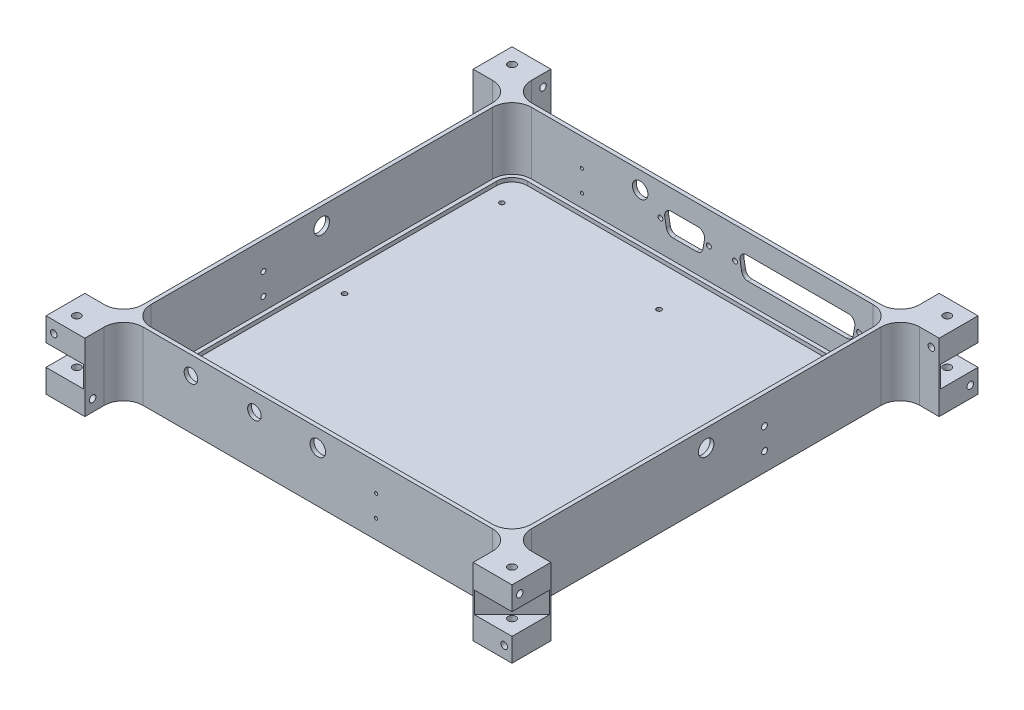
from build123d import *

# Parameters (mm, degrees)
BOSS_EXTRUDE1_DEPTH                = 17.5
CUT_EXTRUDE1_DEPTH                 = 32
CUT_EXTRUDE2_DEPTH                 = 2
BOSS_EXTRUDE2_DEPTH                = 2
CUT_EXTRUDE3_DEPTH                 = 11
CIRPATTERN1_COUNT                  = 4
M3_CLEARANCE_HOLE1_D               = 3.4
M3_CLEARANCE_HOLE1_DEPTH           = 20
M3_CLEARANCE_HOLE1_TIP             = 1.021463052
M3_CLEARANCE_HOLE1_ON_FACE_2_D     = 3.4
M3_CLEARANCE_HOLE1_ON_FACE_2_DEPTH = 20
M3_CLEARANCE_HOLE1_ON_FACE_2_TIP   = 1.021463052
M3_CLEARANCE_HOLE1_ON_FACE_3_D     = 3.4
M3_CLEARANCE_HOLE1_ON_FACE_3_DEPTH = 20
M3_CLEARANCE_HOLE1_ON_FACE_3_TIP   = 1.021463052
M3_CLEARANCE_HOLE1_ON_FACE_4_D     = 3.4
M3_CLEARANCE_HOLE1_ON_FACE_4_DEPTH = 20
M3_CLEARANCE_HOLE1_ON_FACE_4_TIP   = 1.021463052
CUT_EXTRUDE4_REACH                 = 253.357
SKETCH12_R                         = 4
SKETCH12_R_2                       = 1.5
SKETCH13_R                         = 2
CUT_EXTRUDE5_DEPTH                 = 174.692256592
CIRPATTERN2_COUNT                  = 4
M3X0_5_TAPPED_HOLE1_D              = 2.5
M3X0_5_TAPPED_HOLE1_DEPTH          = 5
M3X0_5_TAPPED_HOLE1_TIP            = 0.751075774
CUT_EXTRUDE6_START                 = -10
SKETCH21_R                         = 4
CUT_EXTRUDE6_DEPTH                 = 10
M3X0_5_TAPPED_HOLE2_D              = 2.5
M3X0_5_TAPPED_HOLE2_DEPTH          = 5
M3X0_5_TAPPED_HOLE2_TIP            = 0.751075774
SKETCH24_R                         = 4
SKETCH24_R_2                       = 3.5
CUT_EXTRUDE7_DEPTH                 = 10
M2X0_4_TAPPED_HOLE1_D              = 1.6
M2X0_4_TAPPED_HOLE1_DEPTH          = 5.2
M2X0_4_TAPPED_HOLE1_TIP            = 0.480688495
SKETCH28_R                         = 4
CUT_EXTRUDE8_DEPTH                 = 10
M3X0_5_TAPPED_HOLE3_D              = 2.5
M3X0_5_TAPPED_HOLE3_DEPTH          = 7.5
M3X0_5_TAPPED_HOLE3_TIP            = 0.751075774
M2X0_4_TAPPED_HOLE2_D              = 1.6
M2X0_4_TAPPED_HOLE2_DEPTH          = 5.2
M2X0_4_TAPPED_HOLE2_TIP            = 0.480688495


with BuildPart() as part:
    # Sketch1 → Boss-Extrude1 (new, symmetric)
    with BuildSketch(Plane(origin=(0, 0, 0), x_dir=(1, 0, 0), z_dir=(0, 1, 0))):
        with BuildLine():
            ThreePointArc((-110, 100), (-102.928932188, 97.071067812), (-100, 90))
            Line((-100, 90), (-100, -90))
            ThreePointArc((-100, -90), (-102.928932188, -97.071067812), (-110, -100))
            Line((-110, -100), (-120, -100))
            Line((-120, -100), (-120, -120))
            Line((-120, -120), (-100, -120))
            Line((-100, -120), (-100, -110))
            ThreePointArc((-100, -110), (-97.071067812, -102.928932188), (-90, -100))
            Line((-90, -100), (90, -100))
            ThreePointArc((90, -100), (97.071067812, -102.928932188), (100, -110))
            Line((100, -110), (100, -120))
            Line((100, -120), (120, -120))
            Line((120, -120), (120, -100))
            Line((120, -100), (110, -100))
            ThreePointArc((110, -100), (102.928932188, -97.071067812), (100, -90))
            Line((100, -90), (100, 90))
            ThreePointArc((100, 90), (102.928932188, 97.071067812), (110, 100))
            Line((110, 100), (120, 100))
            Line((120, 100), (120, 120))
            Line((120, 120), (100, 120))
            Line((100, 120), (100, 110))
            ThreePointArc((100, 110), (97.071067812, 102.928932188), (90, 100))
            Line((90, 100), (-90, 100))
            ThreePointArc((-90, 100), (-97.071067812, 102.928932188), (-100, 110))
            Line((-100, 110), (-100, 120))
            Line((-100, 120), (-120, 120))
            Line((-120, 120), (-120, 100))
            Line((-120, 100), (-110, 100))
        make_face()
    extrude(amount=BOSS_EXTRUDE1_DEPTH, both=True)

    # Sketch3 → Cut-Extrude1 (cut)
    with BuildSketch(Plane(origin=(0, 17.5, 0), x_dir=(1, 0, 0), z_dir=(0, 1, 0))):
        with BuildLine():
            Line((-88, 98), (88, 98))
            ThreePointArc((88, 98), (95.071067812, 95.071067812), (98, 88))
            Line((98, 88), (98, -88))
            ThreePointArc((98, -88), (95.071067812, -95.071067812), (88, -98))
            Line((88, -98), (-88, -98))
            ThreePointArc((-88, -98), (-95.071067812, -95.071067812), (-98, -88))
            Line((-98, -88), (-98, 88))
            ThreePointArc((-98, 88), (-95.071067812, 95.071067812), (-88, 98))
        make_face()
    extrude(amount=-CUT_EXTRUDE1_DEPTH, mode=Mode.SUBTRACT)

    # Sketch4 → Cut-Extrude2 (cut)
    with BuildSketch(Plane(origin=(0, -14.5, 0), x_dir=(1, 0, 0), z_dir=(0, 1, 0))):
        with BuildLine():
            Line((-88, -96), (88, -96))
            ThreePointArc((88, -96), (93.656854249, -93.656854249), (96, -88))
            Line((96, -88), (96, 88))
            ThreePointArc((96, 88), (93.656854249, 93.656854249), (88, 96))
            Line((88, 96), (-88, 96))
            ThreePointArc((-88, 96), (-93.656854249, 93.656854249), (-96, 88))
            Line((-96, 88), (-96, -88))
            ThreePointArc((-96, -88), (-93.656854249, -93.656854249), (-88, -96))
        make_face()
    extrude(amount=-CUT_EXTRUDE2_DEPTH, mode=Mode.SUBTRACT)

    # Sketch5 → Boss-Extrude2 (add)
    with BuildSketch(Plane.XZ.offset(17.5)):
        with BuildLine():
            Line((98, -88), (98, 88))
            ThreePointArc((98, 88), (95.071067812, 95.071067812), (88, 98))
            Line((88, 98), (-88, 98))
            ThreePointArc((-88, 98), (-95.071067812, 95.071067812), (-98, 88))
            Line((-98, 88), (-98, -88))
            ThreePointArc((-98, -88), (-95.071067812, -95.071067812), (-88, -98))
            Line((-88, -98), (88, -98))
            ThreePointArc((88, -98), (95.071067812, -95.071067812), (98, -88))
        make_face()
    extrude(amount=BOSS_EXTRUDE2_DEPTH)

    # Sketch6 → Cut-Extrude3 (cut)
    with BuildSketch(Plane(origin=(0, 5.5, 0), x_dir=(1, 0, 0), z_dir=(0, 1, 0))):
        Polygon((-120, 120), (-120, 100.61731573), (-100.61731573, 120), align=None)
    cut_extrude3 = extrude(amount=-CUT_EXTRUDE3_DEPTH, mode=Mode.SUBTRACT)

    # CirPattern1: Cut-Extrude3 ×4 about axis
    cirpattern1_axis = Axis((0, 0, 0), (0, 1, 0))
    for i in range(1, CIRPATTERN1_COUNT):
        add(cut_extrude3.rotate(cirpattern1_axis, i * 360 / CIRPATTERN1_COUNT), mode=Mode.SUBTRACT)

    # M3 Clearance Hole1
    with Locations(Plane(origin=(116, 11.5, -120), x_dir=(-1, 0, 0), z_dir=(0, 0, -1))):
        with Locations((0, 0), (232, -23)):
            Hole(M3_CLEARANCE_HOLE1_D / 2, depth=M3_CLEARANCE_HOLE1_DEPTH)
            with Locations((0, 0, -(M3_CLEARANCE_HOLE1_DEPTH + M3_CLEARANCE_HOLE1_TIP / 2))):  # 118° drill point
                Cone(0, M3_CLEARANCE_HOLE1_D / 2, M3_CLEARANCE_HOLE1_TIP, mode=Mode.SUBTRACT)

    # M3 Clearance Hole1 on face 2
    with Locations(Plane(origin=(120, 11.5, 116), x_dir=(0, 0, 1), z_dir=(1, 0, 0))):
        with Locations((0, 0), (-232, 23)):
            Hole(M3_CLEARANCE_HOLE1_ON_FACE_2_D / 2, depth=M3_CLEARANCE_HOLE1_ON_FACE_2_DEPTH)
            with Locations((0, 0, -(M3_CLEARANCE_HOLE1_ON_FACE_2_DEPTH + M3_CLEARANCE_HOLE1_ON_FACE_2_TIP / 2))):  # 118° drill point
                Cone(0, M3_CLEARANCE_HOLE1_ON_FACE_2_D / 2, M3_CLEARANCE_HOLE1_ON_FACE_2_TIP, mode=Mode.SUBTRACT)

    # M3 Clearance Hole1 on face 3
    with Locations(Plane(origin=(-120, 11.5, -116), x_dir=(0, 0, -1), z_dir=(-1, 0, 0))):
        with Locations((0, 0), (-232, 23)):
            Hole(M3_CLEARANCE_HOLE1_ON_FACE_3_D / 2, depth=M3_CLEARANCE_HOLE1_ON_FACE_3_DEPTH)
            with Locations((0, 0, -(M3_CLEARANCE_HOLE1_ON_FACE_3_DEPTH + M3_CLEARANCE_HOLE1_ON_FACE_3_TIP / 2))):  # 118° drill point
                Cone(0, M3_CLEARANCE_HOLE1_ON_FACE_3_D / 2, M3_CLEARANCE_HOLE1_ON_FACE_3_TIP, mode=Mode.SUBTRACT)

    # M3 Clearance Hole1 on face 4
    with Locations(Plane(origin=(-116, 11.5, 120), x_dir=(1, 0, 0), z_dir=(0, 0, 1))):
        with Locations((0, 0), (232, -23)):
            Hole(M3_CLEARANCE_HOLE1_ON_FACE_4_D / 2, depth=M3_CLEARANCE_HOLE1_ON_FACE_4_DEPTH)
            with Locations((0, 0, -(M3_CLEARANCE_HOLE1_ON_FACE_4_DEPTH + M3_CLEARANCE_HOLE1_ON_FACE_4_TIP / 2))):  # 118° drill point
                Cone(0, M3_CLEARANCE_HOLE1_ON_FACE_4_D / 2, M3_CLEARANCE_HOLE1_ON_FACE_4_TIP, mode=Mode.SUBTRACT)

    # Sketch12 → Cut-Extrude4 (cut, up to next)
    with BuildSketch(Plane(origin=(100, 0, 0), x_dir=(0, 0, -1), z_dir=(1, 0, 0)), mode=Mode.PRIVATE) as cut_extrude4_sk1:
        with Locations((0, 8.6)):
            Circle(SKETCH12_R)
    cut_extrude4_tool1 = extrude(cut_extrude4_sk1.sketch, amount=-CUT_EXTRUDE4_REACH, mode=Mode.PRIVATE) & part.part
    # Sketch12 → Cut-Extrude4 (cut, up to next)
    with BuildSketch(Plane(origin=(100, 0, 0), x_dir=(0, 0, -1), z_dir=(1, 0, 0)), mode=Mode.PRIVATE) as cut_extrude4_sk2:
        with Locations((30, 3.25)):
            Circle(SKETCH12_R_2)
    cut_extrude4_tool2 = extrude(cut_extrude4_sk2.sketch, amount=-CUT_EXTRUDE4_REACH, mode=Mode.PRIVATE) & part.part
    # Sketch12 → Cut-Extrude4 (cut, up to next)
    with BuildSketch(Plane(origin=(100, 0, 0), x_dir=(0, 0, -1), z_dir=(1, 0, 0)), mode=Mode.PRIVATE) as cut_extrude4_sk3:
        with Locations((30.077305636, -7.85)):
            Circle(SKETCH12_R_2)
    cut_extrude4_tool3 = extrude(cut_extrude4_sk3.sketch, amount=-CUT_EXTRUDE4_REACH, mode=Mode.PRIVATE) & part.part
    add(cut_extrude4_tool1.solids().sort_by_distance((100, 8.6, 0))[0], mode=Mode.SUBTRACT)
    add(cut_extrude4_tool2.solids().sort_by_distance((100, 3.25, -30))[0], mode=Mode.SUBTRACT)
    add(cut_extrude4_tool3.solids().sort_by_distance((100, -7.85, -30.077306))[0], mode=Mode.SUBTRACT)

    # Sketch13 → Cut-Extrude5 (cut, through all)
    with BuildSketch(Plane(origin=(0, 17.5, 0), x_dir=(1, 0, 0), z_dir=(0, 1, 0))):
        with Locations((-112.076424818, 112.076424818)):
            Circle(SKETCH13_R)
    cut_extrude5 = extrude(amount=-CUT_EXTRUDE5_DEPTH, mode=Mode.SUBTRACT)

    # CirPattern2: Cut-Extrude5 ×4 about axis
    cirpattern2_axis = Axis((0, 0, 0), (0, 1, 0))
    for i in range(1, CIRPATTERN2_COUNT):
        add(cut_extrude5.rotate(cirpattern2_axis, i * 360 / CIRPATTERN2_COUNT), mode=Mode.SUBTRACT)

    # M3x0.5 Tapped Hole1
    with Locations(Plane(origin=(0, -16.5, 0), x_dir=(1, 0, 0), z_dir=(0, 1, 0))):
        with Locations((-87, 81.75), (1, 74.75), (83, 88.75), (87, 0.75), (87, -87.25), (0, -87.25), (-87, -87.25), (-87, 0.75)):
            Hole(M3X0_5_TAPPED_HOLE1_D / 2, depth=M3X0_5_TAPPED_HOLE1_DEPTH)
            with Locations((0, 0, -(M3X0_5_TAPPED_HOLE1_DEPTH + M3X0_5_TAPPED_HOLE1_TIP / 2))):  # 118° drill point
                Cone(0, M3X0_5_TAPPED_HOLE1_D / 2, M3X0_5_TAPPED_HOLE1_TIP, mode=Mode.SUBTRACT)

    # Sketch21 → Cut-Extrude6 (cut)
    with BuildSketch(Plane.ZY.offset(100).offset(CUT_EXTRUDE6_START)):
        with Locations((0, 8.6)):
            Circle(SKETCH21_R)
    extrude(amount=CUT_EXTRUDE6_DEPTH, mode=Mode.SUBTRACT)

    # M3x0.5 Tapped Hole2
    with Locations(Plane.ZY.offset(100)):
        with Locations((30, 3.25), (30, -7.85)):
            Hole(M3X0_5_TAPPED_HOLE2_D / 2, depth=M3X0_5_TAPPED_HOLE2_DEPTH)
            with Locations((0, 0, -(M3X0_5_TAPPED_HOLE2_DEPTH + M3X0_5_TAPPED_HOLE2_TIP / 2))):  # 118° drill point
                Cone(0, M3X0_5_TAPPED_HOLE2_D / 2, M3X0_5_TAPPED_HOLE2_TIP, mode=Mode.SUBTRACT)

    # Sketch24 → Cut-Extrude7 (cut)
    with BuildSketch(Plane.XY.offset(100)):
        with Locations((0, 8.6)):
            Circle(SKETCH24_R)
        with Locations((-32.67, 8.1)):
            Circle(SKETCH24_R_2)
        with Locations((-65.34, 8.1)):
            Circle(SKETCH24_R_2)
    extrude(amount=-CUT_EXTRUDE7_DEPTH, mode=Mode.SUBTRACT)

    # M2x0.4 Tapped Hole1
    with Locations(Plane.XY.offset(100)):
        with Locations((30, 3.25), (30, -7.85)):
            Hole(M2X0_4_TAPPED_HOLE1_D / 2, depth=M2X0_4_TAPPED_HOLE1_DEPTH)
            with Locations((0, 0, -(M2X0_4_TAPPED_HOLE1_DEPTH + M2X0_4_TAPPED_HOLE1_TIP / 2))):  # 118° drill point
                Cone(0, M2X0_4_TAPPED_HOLE1_D / 2, M2X0_4_TAPPED_HOLE1_TIP, mode=Mode.SUBTRACT)

    # Sketch28 → Cut-Extrude8 (cut)
    with BuildSketch(Plane(origin=(0, 0, -100), x_dir=(-1, 0, 0), z_dir=(0, 0, -1))):
        with Locations((32, 8.6)):
            Circle(SKETCH28_R)
        with BuildLine():
            Line((2.154105973, 7.07), (16.025894027, 7.07))
            ThreePointArc((16.025894027, 7.07), (18.592142912, 5.873338492), (19.325, 3.138278605))
            Line((19.325, 3.138278605), (18.496263191, -1.561721395))
            ThreePointArc((18.496263191, -1.561721395), (17.350495711, -3.546248884), (15.197157218, -4.33))
            Line((15.197157218, -4.33), (2.982842782, -4.33))
            ThreePointArc((2.982842782, -4.33), (0.829504289, -3.546248884), (-0.316263191, -1.561721395))
            Line((-0.316263191, -1.561721395), (-1.145, 3.138278605))
            ThreePointArc((-1.145, 3.138278605), (-0.412142912, 5.873338492), (2.154105973, 7.07))
        make_face()
        with BuildLine():
            Line((-75.240894027, 7.07), (-22.759105973, 7.07))
            ThreePointArc((-22.759105973, 7.07), (-20.192857088, 5.873338492), (-19.46, 3.138278605))
            Line((-19.46, 3.138278605), (-20.288736809, -1.561721395))
            ThreePointArc((-20.288736809, -1.561721395), (-21.434504289, -3.546248884), (-23.587842782, -4.33))
            Line((-23.587842782, -4.33), (-74.412157218, -4.33))
            ThreePointArc((-74.412157218, -4.33), (-76.565495711, -3.546248884), (-77.711263191, -1.561721395))
            Line((-77.711263191, -1.561721395), (-78.54, 3.138278605))
            ThreePointArc((-78.54, 3.138278605), (-77.807142912, 5.873338492), (-75.240894027, 7.07))
        make_face()
    extrude(amount=-CUT_EXTRUDE8_DEPTH, mode=Mode.SUBTRACT)

    # M3x0.5 Tapped Hole3
    with Locations(Plane(origin=(0, 0, -100), x_dir=(-1, 0, 0), z_dir=(0, 0, -1))):
        with Locations((-80.75, 1.36), (-16.85, 1.36), (-3.405, 1.36), (21.585, 1.36)):
            Hole(M3X0_5_TAPPED_HOLE3_D / 2, depth=M3X0_5_TAPPED_HOLE3_DEPTH)
            with Locations((0, 0, -(M3X0_5_TAPPED_HOLE3_DEPTH + M3X0_5_TAPPED_HOLE3_TIP / 2))):  # 118° drill point
                Cone(0, M3X0_5_TAPPED_HOLE3_D / 2, M3X0_5_TAPPED_HOLE3_TIP, mode=Mode.SUBTRACT)

    # M2x0.4 Tapped Hole2
    with Locations(Plane(origin=(0, 0, -100), x_dir=(-1, 0, 0), z_dir=(0, 0, -1))):
        with Locations((62, 3.25), (62, -7.85)):
            Hole(M2X0_4_TAPPED_HOLE2_D / 2, depth=M2X0_4_TAPPED_HOLE2_DEPTH)
            with Locations((0, 0, -(M2X0_4_TAPPED_HOLE2_DEPTH + M2X0_4_TAPPED_HOLE2_TIP / 2))):  # 118° drill point
                Cone(0, M2X0_4_TAPPED_HOLE2_D / 2, M2X0_4_TAPPED_HOLE2_TIP, mode=Mode.SUBTRACT)


solid = part.part
